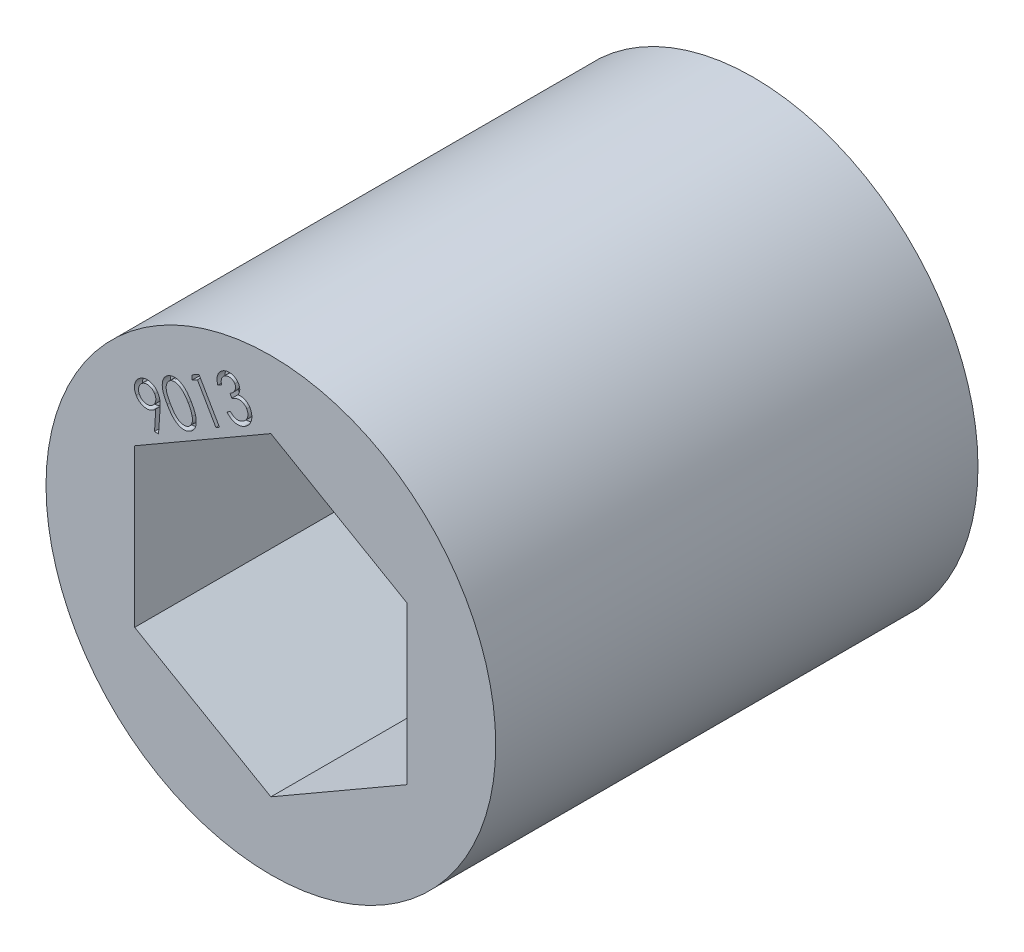
from build123d import *

# Parameters (mm, degrees)
SKETCH1_R           = 11.1125
BOSS_EXTRUDE1_DEPTH = 23.83155
CUT_EXTRUDE1_DEPTH  = 0.4


with BuildPart() as part:
    # Sketch1 → Boss-Extrude1 (new body)
    with BuildSketch(Plane.XY):
        Circle(SKETCH1_R)
        Polygon((6.731, 3.886144662), (0, 7.772289324), (-6.731, 3.886144662), (-6.731, -3.886144662), (0, -7.772289324), (6.731, -3.886144662), align=None, mode=Mode.SUBTRACT)
    extrude(amount=BOSS_EXTRUDE1_DEPTH)

    # Sketch2 → Cut-Extrude1 (cut)
    # profile 1 of 4: a face of its own
    with BuildSketch(Plane.XY.offset(23.83155)):
        with BuildLine():
            Line((-5.551017213, 4.977397314), (-5.749251187, 4.987166545))
            Line((-5.749251187, 4.987166545), (-5.690635802, 5.981592827))
            add(Edge.make_bspline(
                [(-5.690635802, 5.981592827), (-5.703424615, 5.967649666), (-5.728301691, 5.940527127), (-5.768702265, 5.904753712), (-5.809158568, 5.872900229), (-5.837808157, 5.855415281), (-5.85182811, 5.846858853)],
                knots=[0, 0, 0, 0, 1.07557127, 2.092224476, 3.066411598, 4, 4, 4, 4], degree=3))
            add(Edge.make_bspline(
                [(-5.85182811, 5.846858853), (-5.869154937, 5.837403987), (-5.903436827, 5.818697117), (-5.957274038, 5.797324922), (-6.011777804, 5.781495893), (-6.067121583, 5.772388299), (-6.122994595, 5.7680211), (-6.179779214, 5.770204101), (-6.237144994, 5.778491603), (-6.294627573, 5.792310811), (-6.350838893, 5.811204069), (-6.404437582, 5.835308346), (-6.454791038, 5.864316975), (-6.50169661, 5.898314666), (-6.54556442, 5.936767963), (-6.585980324, 5.980076498), (-6.622864202, 6.028488903), (-6.644381414, 6.0634851), (-6.655347341, 6.081320391)],
                knots=[0, 0, 0, 0, 1.015135184, 2.008489705, 2.974464217, 3.930823522, 4.890110555, 5.854468119, 6.84900024, 7.868689235, 8.893387844, 9.896732215, 10.888539014, 11.878968029, 12.873598221, 13.886496971, 14.922884625, 16, 16, 16, 16], degree=3))
            add(Edge.make_bspline(
                [(-6.655347341, 6.081320391), (-6.66882212, 6.106504299), (-6.695333439, 6.156053059), (-6.722177302, 6.234936932), (-6.739663095, 6.314689882), (-6.744471193, 6.395569575), (-6.739642569, 6.476282817), (-6.722468063, 6.555509097), (-6.694898348, 6.632840099), (-6.65675649, 6.707212354), (-6.609289681, 6.776809738), (-6.554302052, 6.840084966), (-6.490857754, 6.895073909), (-6.443558755, 6.924783238), (-6.419664649, 6.939791545)],
                knots=[0, 0, 0, 0, 1.035324533, 2.036977218, 3.013660684, 3.991039457, 4.968418229, 5.940283026, 6.923354643, 7.941094773, 8.965736768, 9.974485588, 10.976767849, 12, 12, 12, 12], degree=3))
            add(Edge.make_bspline(
                [(-6.419664649, 6.939791545), (-6.395287342, 6.952834679), (-6.347079333, 6.978628486), (-6.269741004, 7.004883704), (-6.19025471, 7.020982958), (-6.109252171, 7.026576322), (-6.028163273, 7.021949729), (-5.949037287, 7.005815277), (-5.872302373, 6.979208771), (-5.799776271, 6.941151341), (-5.731842242, 6.895020467), (-5.67075385, 6.841063668), (-5.617507563, 6.77949701), (-5.588713266, 6.73368299), (-5.574219136, 6.710621673)],
                knots=[0, 0, 0, 0, 1.019400264, 2.015942902, 3.002372847, 4.006779929, 5.005536382, 5.991966327, 6.979044859, 7.994053264, 9.007032045, 10.004279611, 10.995418019, 12, 12, 12, 12], degree=3))
            add(Edge.make_bspline(
                [(-5.574219136, 6.710621673), (-5.564223143, 6.691935605), (-5.543880739, 6.653908412), (-5.51966391, 6.592463372), (-5.500265281, 6.526621553), (-5.487687597, 6.468604125), (-5.480281874, 6.419270262), (-5.475622394, 6.379100425), (-5.473190393, 6.336152777), (-5.470829761, 6.290435872), (-5.470676582, 6.242100503), (-5.471482192, 6.190938817), (-5.473494303, 6.137056902), (-5.47577026, 6.10017623), (-5.476933879, 6.081320391)],
                knots=[0, 0, 0, 0, 1.179517641, 2.400384276, 3.669978525, 4.99951221, 5.702757638, 6.447991837, 7.250775919, 8.098000084, 8.997311831, 9.942054579, 10.947842213, 12, 12, 12, 12], degree=3))
            Line((-5.476933879, 6.081320391), (-5.551017213, 4.977397314))
        make_face()
        with BuildLine():
            add(Edge.make_bspline(
                [(-5.900267213, 6.024333212), (-5.887748438, 6.031951385), (-5.863162486, 6.046912917), (-5.829698661, 6.073374129), (-5.799206246, 6.10178549), (-5.772766446, 6.133442564), (-5.749402283, 6.167351606), (-5.729446764, 6.203792494), (-5.712499443, 6.242669197), (-5.699922705, 6.283847111), (-5.690284703, 6.32584971), (-5.685675992, 6.36803353), (-5.684125537, 6.409584218), (-5.68742262, 6.450697933), (-5.695393769, 6.49096467), (-5.706712654, 6.53088176), (-5.722700683, 6.570117517), (-5.736260233, 6.595271974), (-5.743145418, 6.60804475)],
                knots=[0, 0, 0, 0, 1.045108442, 2.052516081, 3.039037663, 4.014948609, 4.990090363, 5.974041511, 6.976128051, 8.011453109, 9.043011603, 10.047295345, 11.035574291, 12.007150616, 12.98344593, 13.961229243, 14.964765542, 16, 16, 16, 16], degree=3))
            add(Edge.make_bspline(
                [(-5.743145418, 6.60804475), (-5.750629929, 6.620424138), (-5.765422436, 6.644890957), (-5.791648172, 6.678198649), (-5.820335976, 6.708286325), (-5.851825577, 6.734758077), (-5.885775862, 6.758056997), (-5.922095942, 6.778155051), (-5.96118235, 6.794463779), (-6.002231671, 6.807255197), (-6.044294989, 6.816610008), (-6.086394175, 6.822105778), (-6.128010867, 6.822827988), (-6.169040019, 6.819547762), (-6.20962251, 6.812308714), (-6.249587717, 6.800190712), (-6.289355435, 6.784591155), (-6.314516679, 6.770617666), (-6.327264008, 6.76353834)],
                knots=[0, 0, 0, 0, 1.031712043, 2.039092063, 3.018573684, 3.994457873, 4.969572892, 5.953497063, 6.951758218, 7.98705489, 9.018585102, 10.024008046, 11.012022604, 11.983572292, 12.958061913, 13.947831088, 14.960318852, 16, 16, 16, 16], degree=3))
            add(Edge.make_bspline(
                [(-6.327264008, 6.76353834), (-6.339669246, 6.756085211), (-6.364095572, 6.741409753), (-6.397036414, 6.714754951), (-6.427534506, 6.686517534), (-6.453915714, 6.654813893), (-6.477394484, 6.621044953), (-6.496773288, 6.584363002), (-6.513843193, 6.545627216), (-6.526378474, 6.50442667), (-6.536027924, 6.462430139), (-6.540617764, 6.42037981), (-6.542182734, 6.378966103), (-6.538885009, 6.337987661), (-6.530916952, 6.297721), (-6.519597233, 6.257803889), (-6.50360943, 6.218568138), (-6.490049849, 6.19341368), (-6.483164649, 6.180640904)],
                knots=[0, 0, 0, 0, 1.034021631, 2.036022986, 3.024725885, 4.002794686, 4.980092595, 5.961574923, 6.965877195, 8.00349148, 9.037330872, 10.043835206, 11.024597356, 11.998321951, 12.97677597, 13.956721278, 14.962476515, 16, 16, 16, 16], degree=3))
            add(Edge.make_bspline(
                [(-6.483164649, 6.180640904), (-6.475680462, 6.168261022), (-6.460888597, 6.143793228), (-6.43465818, 6.110492656), (-6.405987582, 6.080378809), (-6.374520089, 6.054075631), (-6.340908026, 6.030467572), (-6.304506888, 6.01065349), (-6.265646289, 5.993681935), (-6.224463897, 5.981111934), (-6.1824625, 5.971472124), (-6.140278369, 5.966863883), (-6.098727762, 5.965313305), (-6.057614025, 5.968610421), (-6.017347294, 5.97658156), (-5.977430202, 5.987900448), (-5.938194446, 6.003888477), (-5.913039988, 6.017448027), (-5.900267213, 6.024333212)],
                knots=[0, 0, 0, 0, 1.033571637, 2.042767394, 3.024014467, 4.001657624, 4.970548117, 5.956245748, 6.96011096, 7.997273687, 9.030663166, 10.03672948, 11.026762591, 12.000063433, 12.97809164, 13.957610489, 14.962928033, 16, 16, 16, 16], degree=3))
        make_face(mode=Mode.SUBTRACT)
    # profile 2 of 4: a face of its own
    with BuildSketch(Plane.XY.offset(23.83155)):
        with BuildLine():
            add(Edge.make_bspline(
                [(-5.122580453, 6.455807571), (-5.138665371, 6.484051068), (-5.169948184, 6.538980544), (-5.212057801, 6.620906546), (-5.249752303, 6.698931579), (-5.281990557, 6.773465525), (-5.309066901, 6.844310784), (-5.330642477, 6.911613804), (-5.347741187, 6.975238245), (-5.359141371, 7.035825173), (-5.36612643, 7.093772727), (-5.369311941, 7.149510909), (-5.369515552, 7.20348742), (-5.365847566, 7.255729703), (-5.358595333, 7.306227297), (-5.347576846, 7.354962952), (-5.332811462, 7.401852102), (-5.314926872, 7.447046293), (-5.293992703, 7.490245342), (-5.269110018, 7.530534999), (-5.242573068, 7.56902098), (-5.212527389, 7.604380617), (-5.180329018, 7.637788519), (-5.144758106, 7.668046922), (-5.106873614, 7.69652151), (-5.079717174, 7.713004413), (-5.066000325, 7.721330006)],
                knots=[0, 0, 0, 0, 1.642217524, 3.193873097, 4.653599743, 6.020219012, 7.296149585, 8.484364078, 9.590266645, 10.622995624, 11.596731579, 12.537641419, 13.442669779, 14.322439731, 15.181528583, 16.018162769, 16.844365298, 17.663022962, 18.472528165, 19.266229043, 20.053716379, 20.832379209, 21.608138827, 22.395685855, 23.18965321, 24, 24, 24, 24], degree=3))
            add(Edge.make_bspline(
                [(-5.066000325, 7.721330006), (-5.051738214, 7.729171387), (-5.023463773, 7.744716818), (-4.979188691, 7.763622306), (-4.93459539, 7.779753714), (-4.888927258, 7.791578743), (-4.842640645, 7.799677652), (-4.795415965, 7.804199984), (-4.747509098, 7.804981111), (-4.698945914, 7.802052014), (-4.649880529, 7.795698705), (-4.600749907, 7.784628904), (-4.551772424, 7.769280549), (-4.5025152, 7.750777465), (-4.453970029, 7.726858747), (-4.405209154, 7.699375145), (-4.356305558, 7.668182287), (-4.307845544, 7.63201616), (-4.258833505, 7.59151437), (-4.210336946, 7.545100874), (-4.16162618, 7.493112407), (-4.113431947, 7.435353758), (-4.065387926, 7.371848738), (-4.016768651, 7.303155257), (-3.968998419, 7.228188495), (-3.938044662, 7.175836985), (-3.922186223, 7.149015904)],
                knots=[0, 0, 0, 0, 0.815881076, 1.617473213, 2.411751612, 3.192532544, 3.980223438, 4.766442947, 5.569622482, 6.380892254, 7.204795063, 8.048528362, 8.903143009, 9.777765604, 10.684831081, 11.614241792, 12.584586996, 13.591843045, 14.645331516, 15.771781295, 16.956234458, 18.217113798, 19.542884518, 20.949560407, 22.437178076, 24, 24, 24, 24], degree=3))
            add(Edge.make_bspline(
                [(-3.922186223, 7.149015904), (-3.906983144, 7.121958121), (-3.877332662, 7.069187471), (-3.836346437, 6.990701743), (-3.801141297, 6.914619371), (-3.770236543, 6.841564883), (-3.7446811, 6.77129025), (-3.723603428, 6.703845964), (-3.707675746, 6.639143672), (-3.696473423, 6.576998197), (-3.690241173, 6.517122832), (-3.686535642, 6.459516393), (-3.687679004, 6.403773193), (-3.691342371, 6.34985667), (-3.699751843, 6.297818264), (-3.710964078, 6.247544256), (-3.726058231, 6.199332746), (-3.744911998, 6.153280259), (-3.766705589, 6.109388791), (-3.7918985, 6.068157265), (-3.818946505, 6.028953368), (-3.849160929, 5.992418737), (-3.882916594, 5.959205719), (-3.918548683, 5.927759733), (-3.957113895, 5.898859786), (-3.984721352, 5.882177995), (-3.998711864, 5.873724237)],
                knots=[0, 0, 0, 0, 1.558572261, 3.039675171, 4.44500239, 5.767404933, 7.021920233, 8.19867626, 9.314183841, 10.366093107, 11.366862767, 12.335955634, 13.262731656, 14.164729598, 15.047477431, 15.907015182, 16.749641984, 17.580952634, 18.403702246, 19.207672054, 20.005351578, 20.794016824, 21.584181799, 22.380929523, 23.179510693, 24, 24, 24, 24], degree=3))
            add(Edge.make_bspline(
                [(-3.998711864, 5.873724237), (-4.012724875, 5.86607272), (-4.040548981, 5.850879938), (-4.083698275, 5.831588665), (-4.127967083, 5.816725145), (-4.172610848, 5.804604859), (-4.218176956, 5.79711787), (-4.264269821, 5.79244742), (-4.311227907, 5.791762497), (-4.358761808, 5.7944343), (-4.406474678, 5.801629337), (-4.454270136, 5.811900064), (-4.501568348, 5.827416456), (-4.548998423, 5.846054336), (-4.596274196, 5.869037638), (-4.643519274, 5.895865245), (-4.690394915, 5.927101325), (-4.737624637, 5.962151779), (-4.784547328, 6.002829292), (-4.832004428, 6.049148509), (-4.879885886, 6.101570375), (-4.927835225, 6.16047999), (-4.976410777, 6.225327922), (-5.024895947, 6.296604904), (-5.074493616, 6.373649307), (-5.106228399, 6.427869438), (-5.122580453, 6.455807571)],
                knots=[0, 0, 0, 0, 0.807491903, 1.603348545, 2.386916451, 3.167713854, 3.940658363, 4.719915701, 5.50935356, 6.313835313, 7.125313705, 7.947948844, 8.783651521, 9.640150085, 10.524255013, 11.440287308, 12.386399569, 13.372019105, 14.413529699, 15.525036669, 16.724996316, 18.002813491, 19.365932914, 20.822335035, 22.362637201, 24, 24, 24, 24], degree=3))
        make_face()
        with BuildLine():
            add(Edge.make_bspline(
                [(-4.954468274, 6.548208212), (-4.940499767, 6.52424229), (-4.913450632, 6.477833794), (-4.871808768, 6.411787484), (-4.831102432, 6.351197148), (-4.791814041, 6.295689193), (-4.753207841, 6.245887563), (-4.71524586, 6.201913848), (-4.678684078, 6.162939685), (-4.642610427, 6.129257181), (-4.606747401, 6.100020503), (-4.570900472, 6.074249272), (-4.534677884, 6.051889907), (-4.498404096, 6.032623617), (-4.461786036, 6.016631144), (-4.425017053, 6.00344594), (-4.387719936, 5.99426153), (-4.338873495, 5.98551314), (-4.278891125, 5.98216353), (-4.209580728, 5.989087841), (-4.143989152, 6.006196909), (-4.104377903, 6.026438139), (-4.084599684, 6.03654475)],
                knots=[0, 0, 0, 0, 1.475228016, 2.856686104, 4.15161897, 5.357081144, 6.47289893, 7.501387829, 8.445726694, 9.313720896, 10.124066195, 10.905058304, 11.660046733, 12.386348828, 13.08755313, 13.783651734, 14.460982071, 15.127735434, 16.421461315, 17.639985157, 18.821625413, 20, 20, 20, 20], degree=3))
            add(Edge.make_bspline(
                [(-4.084599684, 6.03654475), (-4.065798659, 6.048668127), (-4.028409368, 6.072777688), (-3.980541395, 6.120562039), (-3.940536516, 6.176481958), (-3.913790555, 6.229104857), (-3.897290047, 6.274791825), (-3.886864366, 6.311023423), (-3.880181317, 6.349093074), (-3.87593008, 6.388539464), (-3.875486829, 6.429499469), (-3.876874981, 6.471933307), (-3.881871644, 6.515850004), (-3.887277829, 6.545387423), (-3.890029171, 6.56041975)],
                knots=[0, 0, 0, 0, 1.342886321, 2.670576022, 4.038999414, 5.466462105, 6.205051725, 6.959707281, 7.731476591, 8.527516338, 9.344012544, 10.193626534, 11.080691652, 12, 12, 12, 12], degree=3))
            add(Edge.make_bspline(
                [(-3.890029171, 6.56041975), (-3.893871794, 6.579468903), (-3.901692425, 6.618238367), (-3.917951885, 6.676400748), (-3.937063408, 6.736072257), (-3.959770652, 6.796782729), (-3.986167566, 6.858560029), (-4.015369384, 6.921675864), (-4.048344802, 6.986056362), (-4.072631893, 7.028754029), (-4.085006735, 7.050509494)],
                knots=[0, 0, 0, 0, 0.879876913, 1.790754508, 2.73331625, 3.717259664, 4.725112015, 5.77538776, 6.866507818, 8, 8, 8, 8], degree=3))
            add(Edge.make_bspline(
                [(-4.085006735, 7.050509494), (-4.097593519, 7.072050174), (-4.12222066, 7.114196395), (-4.161095748, 7.174180085), (-4.199208967, 7.230679586), (-4.237865602, 7.282877396), (-4.276987178, 7.330713882), (-4.315586991, 7.375058626), (-4.3546899, 7.41491071), (-4.393855857, 7.450883417), (-4.432930298, 7.482982971), (-4.471464057, 7.51168021), (-4.510095606, 7.536186794), (-4.548283661, 7.557570381), (-4.58646503, 7.574953068), (-4.624212342, 7.5890869), (-4.661815099, 7.599364005), (-4.710820246, 7.607718186), (-4.77044596, 7.611156876), (-4.839297802, 7.604877956), (-4.904255282, 7.5876088), (-4.943498929, 7.567631096), (-4.963016351, 7.557695391)],
                knots=[0, 0, 0, 0, 1.327522451, 2.597413504, 3.803087542, 4.954092809, 6.052504639, 7.091116491, 8.08170511, 9.022070092, 9.919800897, 10.771882377, 11.577119672, 12.352806521, 13.099205072, 13.807429758, 14.495830891, 15.170113202, 16.450227669, 17.661618134, 18.837030004, 20, 20, 20, 20], degree=3))
            add(Edge.make_bspline(
                [(-4.963016351, 7.557695391), (-4.981845086, 7.545597239), (-5.019369889, 7.521486177), (-5.067005462, 7.473095403), (-5.107832291, 7.416860031), (-5.134241258, 7.363224177), (-5.151810098, 7.317167957), (-5.161239461, 7.280355349), (-5.168746757, 7.242338406), (-5.173314566, 7.202726666), (-5.174155905, 7.161635677), (-5.173274858, 7.119187623), (-5.168328748, 7.075481912), (-5.161651399, 7.029859182), (-5.150829042, 6.981692283), (-5.135611709, 6.930345188), (-5.115832911, 6.875456721), (-5.092232697, 6.816728281), (-5.064035929, 6.754641728), (-5.031647861, 6.688850546), (-4.995220436, 6.619363941), (-4.968328606, 6.572409186), (-4.954468274, 6.548208212)],
                knots=[0, 0, 0, 0, 1.186584607, 2.364808541, 3.584028067, 4.867913378, 5.52979883, 6.201670858, 6.884946004, 7.589109066, 8.317961587, 9.068444384, 9.84432244, 10.65432116, 11.518850237, 12.466086659, 13.499587148, 14.619373863, 15.830028341, 17.123623296, 18.517485242, 20, 20, 20, 20], degree=3))
        make_face(mode=Mode.SUBTRACT)
    # profile 3 of 4: a face of its own
    with BuildSketch(Plane.XY.offset(23.83155)):
        Polygon((-3.902021899, 8.334349237), (-3.556435361, 8.533804365), (-2.540435361, 6.774935776), (-2.715060361, 6.673987058), (-3.631332797, 8.260672955), (-3.907313566, 8.101515904), align=None)
    # profile 4 of 4: a face of its own
    with BuildSketch(Plane.XY.offset(23.83155)):
        with BuildLine():
            Line((-2.44171014, 8.633531929), (-2.621219755, 8.529733853))
            add(Edge.make_bspline(
                [(-2.621219755, 8.529733853), (-2.627070904, 8.549878046), (-2.638565427, 8.589451106), (-2.650574458, 8.64893765), (-2.658691206, 8.706847979), (-2.661210746, 8.763210148), (-2.66059683, 8.817998103), (-2.653536082, 8.871161125), (-2.643363037, 8.923062393), (-2.62763078, 8.973081039), (-2.60822677, 9.021039834), (-2.584942635, 9.066410868), (-2.557928652, 9.109138269), (-2.526889856, 9.148851319), (-2.492605214, 9.186354179), (-2.454131078, 9.220310232), (-2.41237885, 9.252163308), (-2.382187224, 9.270560791), (-2.366812704, 9.279929365)],
                knots=[0, 0, 0, 0, 1.167375888, 2.293297889, 3.375521375, 4.419309756, 5.431795653, 6.421221817, 7.400474185, 8.372943568, 9.335237775, 10.277820939, 11.20827897, 12.145093331, 13.080597184, 14.032877155, 14.998279508, 16, 16, 16, 16], degree=3))
            add(Edge.make_bspline(
                [(-2.366812704, 9.279929365), (-2.343898417, 9.292228522), (-2.298492475, 9.316599989), (-2.225572102, 9.341925048), (-2.150762758, 9.358972735), (-2.074437837, 9.365963302), (-1.998977036, 9.364720114), (-1.925994721, 9.353662487), (-1.85663016, 9.333250308), (-1.791699904, 9.30350516), (-1.732445344, 9.266166204), (-1.679920553, 9.222689152), (-1.634042758, 9.173731744), (-1.610485987, 9.136255224), (-1.598706935, 9.117515904)],
                knots=[0, 0, 0, 0, 1.074200881, 2.128589237, 3.18106411, 4.240964204, 5.290667332, 6.295500042, 7.284584252, 8.271564568, 9.240038417, 10.172728565, 11.086312573, 12, 12, 12, 12], degree=3))
            add(Edge.make_bspline(
                [(-1.598706935, 9.117515904), (-1.588626956, 9.098645273), (-1.568827532, 9.061578964), (-1.549493959, 9.002246405), (-1.53822188, 8.942037468), (-1.535614588, 8.880569783), (-1.54295287, 8.818121076), (-1.558896333, 8.754822421), (-1.582746732, 8.690127752), (-1.605098411, 8.648481309), (-1.616617191, 8.627019109)],
                knots=[0, 0, 0, 0, 0.993684363, 1.951827249, 2.889052743, 3.836657995, 4.80211292, 5.803367142, 6.867980745, 8, 8, 8, 8], degree=3))
            add(Edge.make_bspline(
                [(-1.616617191, 8.627019109), (-1.591000119, 8.629693987), (-1.540503865, 8.634966694), (-1.465014343, 8.631723166), (-1.39147522, 8.620088369), (-1.344804373, 8.60434819), (-1.321505012, 8.596490263)],
                knots=[0, 0, 0, 0, 1.030179289, 2.030684612, 3.016863995, 4, 4, 4, 4], degree=3))
            add(Edge.make_bspline(
                [(-1.321505012, 8.596490263), (-1.305666682, 8.590070766), (-1.274415236, 8.577404119), (-1.229670525, 8.554594686), (-1.18840188, 8.527855103), (-1.149183082, 8.499152368), (-1.113866992, 8.46637948), (-1.081526801, 8.430553754), (-1.05147258, 8.392072704), (-1.034527827, 8.363979364), (-1.025985781, 8.349817186)],
                knots=[0, 0, 0, 0, 1.043578998, 2.059140917, 3.061497247, 4.0443764, 5.023860692, 5.997754617, 6.990644963, 8, 8, 8, 8], degree=3))
            add(Edge.make_bspline(
                [(-1.025985781, 8.349817186), (-1.012607556, 8.324508528), (-0.985973782, 8.274123288), (-0.959440622, 8.192156186), (-0.942816656, 8.106732599), (-0.939174695, 8.033152857), (-0.94120668, 7.97387404), (-0.945739256, 7.929823303), (-0.952899188, 7.886501878), (-0.963720608, 7.844324774), (-0.976637739, 7.80271523), (-0.993059273, 7.762334979), (-1.011722845, 7.722444657), (-1.041154209, 7.671148749), (-1.083939721, 7.610011802), (-1.145430238, 7.543621818), (-1.215947179, 7.483470054), (-1.269196679, 7.450641359), (-1.296267832, 7.433951801)],
                knots=[0, 0, 0, 0, 1.28952471, 2.567224695, 3.869920332, 5.206510985, 5.880363085, 6.54494688, 7.203155964, 7.859426282, 8.508028052, 9.167374921, 9.824586825, 10.493554763, 11.833631796, 13.181071791, 14.566904166, 16, 16, 16, 16], degree=3))
            add(Edge.make_bspline(
                [(-1.296267832, 7.433951801), (-1.315102907, 7.423592121), (-1.351945546, 7.403327908), (-1.409076747, 7.378811219), (-1.465998827, 7.359698919), (-1.522983939, 7.345481381), (-1.580144885, 7.337467958), (-1.637227695, 7.334566437), (-1.694353969, 7.336964604), (-1.751219419, 7.345108878), (-1.807675882, 7.359012266), (-1.863048529, 7.378744048), (-1.917632543, 7.403536179), (-1.97064578, 7.434930236), (-2.022849903, 7.471588626), (-2.073773997, 7.51418548), (-2.12366046, 7.56239058), (-2.154974411, 7.597772496), (-2.171021037, 7.615903724)],
                knots=[0, 0, 0, 0, 1.049948212, 2.053767481, 3.032934156, 3.981728119, 4.919406159, 5.848819654, 6.771301382, 7.708979423, 8.651334191, 9.607581917, 10.577750219, 11.57619022, 12.613670697, 13.691816969, 14.817186887, 16, 16, 16, 16], degree=3))
            Line((-2.171021037, 7.615903724), (-1.998838345, 7.715631288))
            add(Edge.make_bspline(
                [(-1.998838345, 7.715631288), (-1.986967899, 7.704163481), (-1.963898896, 7.681876966), (-1.929099926, 7.650534455), (-1.89381649, 7.62398548), (-1.859800293, 7.599836228), (-1.825537514, 7.580450437), (-1.791915424, 7.564497806), (-1.759038949, 7.551347042), (-1.736640508, 7.546039446), (-1.725706935, 7.543448596)],
                knots=[0, 0, 0, 0, 1.210652835, 2.352780436, 3.431589675, 4.447423396, 5.410202577, 6.313818959, 7.176907658, 8, 8, 8, 8], degree=3))
            add(Edge.make_bspline(
                [(-1.725706935, 7.543448596), (-1.712039513, 7.540989287), (-1.684715783, 7.536072667), (-1.643225883, 7.533892294), (-1.601479707, 7.535342928), (-1.559846889, 7.54174119), (-1.517768797, 7.551364774), (-1.476030935, 7.565997005), (-1.433688069, 7.583631253), (-1.406576726, 7.598799573), (-1.392738986, 7.606541545)],
                knots=[0, 0, 0, 0, 0.960250092, 1.919719324, 2.868886039, 3.84629253, 4.830262792, 5.851782114, 6.90354087, 8, 8, 8, 8], degree=3))
            add(Edge.make_bspline(
                [(-1.392738986, 7.606541545), (-1.377365947, 7.61591292), (-1.347339584, 7.634216933), (-1.306159392, 7.665542274), (-1.268725531, 7.698238457), (-1.236449423, 7.734141162), (-1.208132479, 7.771814306), (-1.184952173, 7.812180277), (-1.165500366, 7.854298824), (-1.151061652, 7.898481566), (-1.141166329, 7.943249288), (-1.134682778, 7.987611151), (-1.133268921, 8.031109624), (-1.135349533, 8.07386276), (-1.14303512, 8.11553679), (-1.154353283, 8.156507557), (-1.170296377, 8.196592044), (-1.183943945, 8.222124426), (-1.19084155, 8.235028724)],
                knots=[0, 0, 0, 0, 1.172050046, 2.289228593, 3.365994221, 4.4046504, 5.428153963, 6.430175887, 7.430832577, 8.445405442, 9.451045979, 10.414758793, 11.361131048, 12.281855893, 13.19730531, 14.115140933, 15.047375022, 16, 16, 16, 16], degree=3))
            add(Edge.make_bspline(
                [(-1.19084155, 8.235028724), (-1.20135877, 8.251525477), (-1.222270431, 8.284326397), (-1.262166719, 8.32741411), (-1.308048473, 8.364742354), (-1.35974542, 8.395380675), (-1.415043582, 8.419438582), (-1.473185395, 8.435187833), (-1.533117538, 8.441933458), (-1.584372014, 8.440949693), (-1.627160658, 8.435593346), (-1.662243751, 8.428109812), (-1.699869116, 8.417278318), (-1.740458344, 8.404334604), (-1.783601052, 8.38789242), (-1.829419267, 8.368315742), (-1.877980709, 8.34584483), (-1.910956711, 8.329414219), (-1.928011422, 8.320916545)],
                knots=[0, 0, 0, 0, 1.125477117, 2.237815228, 3.366086006, 4.523243477, 5.689477863, 6.831212969, 7.980419195, 9.153421689, 9.776008207, 10.462965099, 11.217962149, 12.031419499, 12.917219526, 13.877107796, 14.902070915, 16, 16, 16, 16], degree=3))
            Line((-1.928011422, 8.320916545), (-2.021226165, 8.482515904))
            add(Edge.make_bspline(
                [(-2.021226165, 8.482515904), (-2.001890332, 8.494552168), (-1.963909712, 8.518194529), (-1.911409838, 8.558352001), (-1.865734884, 8.603298967), (-1.825604414, 8.650434076), (-1.792255617, 8.698945762), (-1.767524973, 8.747884101), (-1.75062875, 8.795744271), (-1.742939286, 8.842851064), (-1.742321748, 8.888339559), (-1.749212619, 8.932002985), (-1.7614488, 8.974143042), (-1.775044663, 8.999936173), (-1.781880012, 9.012903724)],
                knots=[0, 0, 0, 0, 1.266180123, 2.487108066, 3.66629058, 4.822683044, 5.925529858, 6.931065459, 7.864004537, 8.736007996, 9.57354566, 10.382383672, 11.186739966, 12, 12, 12, 12], degree=3))
            add(Edge.make_bspline(
                [(-1.781880012, 9.012903724), (-1.787673775, 9.022116039), (-1.799123037, 9.040320821), (-1.819274457, 9.06534261), (-1.841646887, 9.087726698), (-1.866258718, 9.10754479), (-1.893439556, 9.124248463), (-1.922906812, 9.138516799), (-1.954638539, 9.150341561), (-1.988348592, 9.15911188), (-2.023029153, 9.165335854), (-2.058246481, 9.167852366), (-2.093366779, 9.166295898), (-2.128642277, 9.162633981), (-2.163583029, 9.154152872), (-2.198602711, 9.142673946), (-2.233577558, 9.12760513), (-2.256321898, 9.115254537), (-2.267899242, 9.108967827)],
                knots=[0, 0, 0, 0, 0.946865682, 1.871134866, 2.789952873, 3.69761661, 4.615446926, 5.561132897, 6.544151416, 7.558468937, 8.589704286, 9.608072091, 10.624588379, 11.647331576, 12.690339784, 13.747500356, 14.853430691, 16, 16, 16, 16], degree=3))
            add(Edge.make_bspline(
                [(-2.267899242, 9.108967827), (-2.285792677, 9.097564682), (-2.320791724, 9.075260456), (-2.365880758, 9.033203348), (-2.401499987, 8.984759688), (-2.424722591, 8.940373102), (-2.438300045, 8.901809125), (-2.445955507, 8.870306852), (-2.451233248, 8.836399057), (-2.453812463, 8.800201576), (-2.454904316, 8.761728909), (-2.452417509, 8.720986352), (-2.44862119, 8.677890119), (-2.444053359, 8.64857175), (-2.44171014, 8.633531929)],
                knots=[0, 0, 0, 0, 1.400382439, 2.739108122, 4.046622513, 5.35815942, 6.033190176, 6.744421047, 7.497821892, 8.298419774, 9.141582518, 10.039481475, 10.994287596, 12, 12, 12, 12], degree=3))
        make_face()
    extrude(amount=-CUT_EXTRUDE1_DEPTH, mode=Mode.SUBTRACT)


solid = part.part
